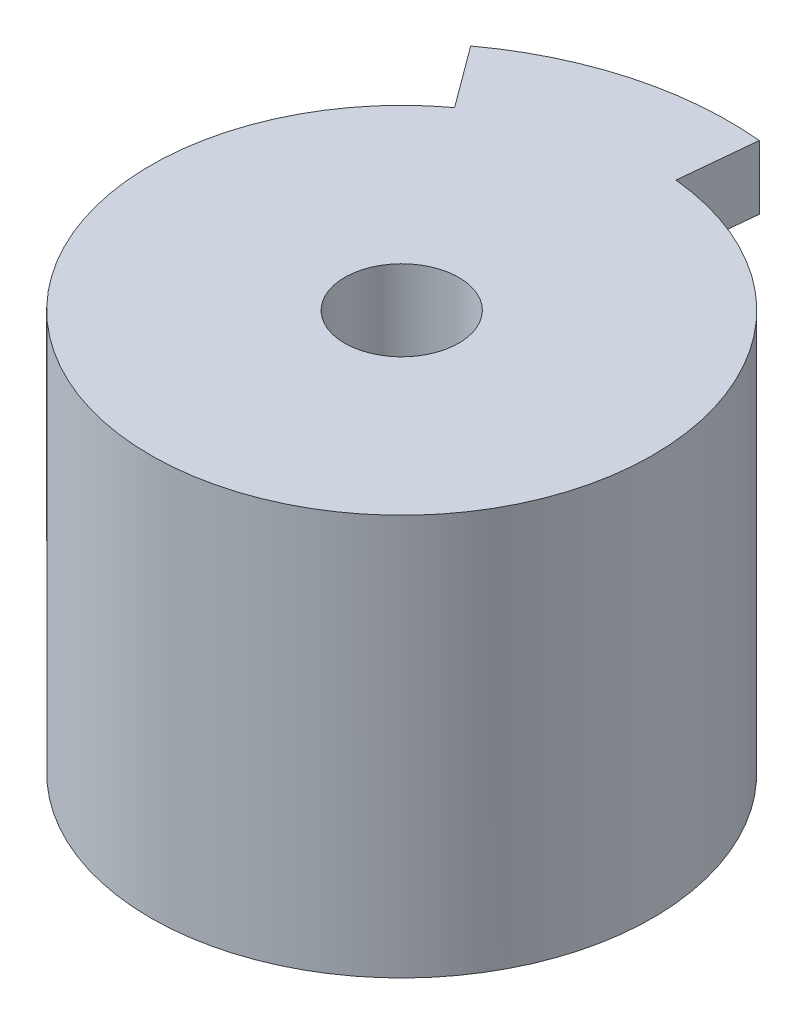
from build123d import *

# Parameters (mm, degrees)
SKETCH1_R           = 12.655
BOSS_EXTRUDE1_DEPTH = 20.2
BOSS_EXTRUDE2_DEPTH = 3.22
SKETCH3_R           = 2.875
CUT_EXTRUDE1_DEPTH  = 8.5


with BuildPart() as part:
    # Sketch1 → Boss-Extrude1 (new body)
    with BuildSketch(Plane(origin=(0, 0, 0), x_dir=(1, 0, 0), z_dir=(0, 1, 0))):
        with Locations(Location((0, 0, 0), (0, 0, 270))):
            Circle(SKETCH1_R)
    extrude(amount=BOSS_EXTRUDE1_DEPTH)

    # Sketch2 → Boss-Extrude2 (add)
    with BuildSketch(Plane(origin=(0, 20.2, 0), x_dir=(1, 0, 0), z_dir=(0, 1, 0))):
        with BuildLine():
            Line((1.600897841, 16.422153516), (0, 0))
            Line((0, 0), (-9.798866593, 13.275248151))
            ThreePointArc((-9.798866593, 13.275248151), (-4.390606594, 15.90511156), (1.600897841, 16.422153516))
        make_face()
    extrude(amount=-BOSS_EXTRUDE2_DEPTH)

    # Sketch3 → Cut-Extrude1 (cut)
    with BuildSketch(Plane(origin=(0, 20.2, 0), x_dir=(1, 0, 0), z_dir=(0, 1, 0))):
        with Locations(Location((0, 0, 0), (0, 0, 270))):
            Circle(SKETCH3_R)
    extrude(amount=-CUT_EXTRUDE1_DEPTH, mode=Mode.SUBTRACT)


solid = part.part
